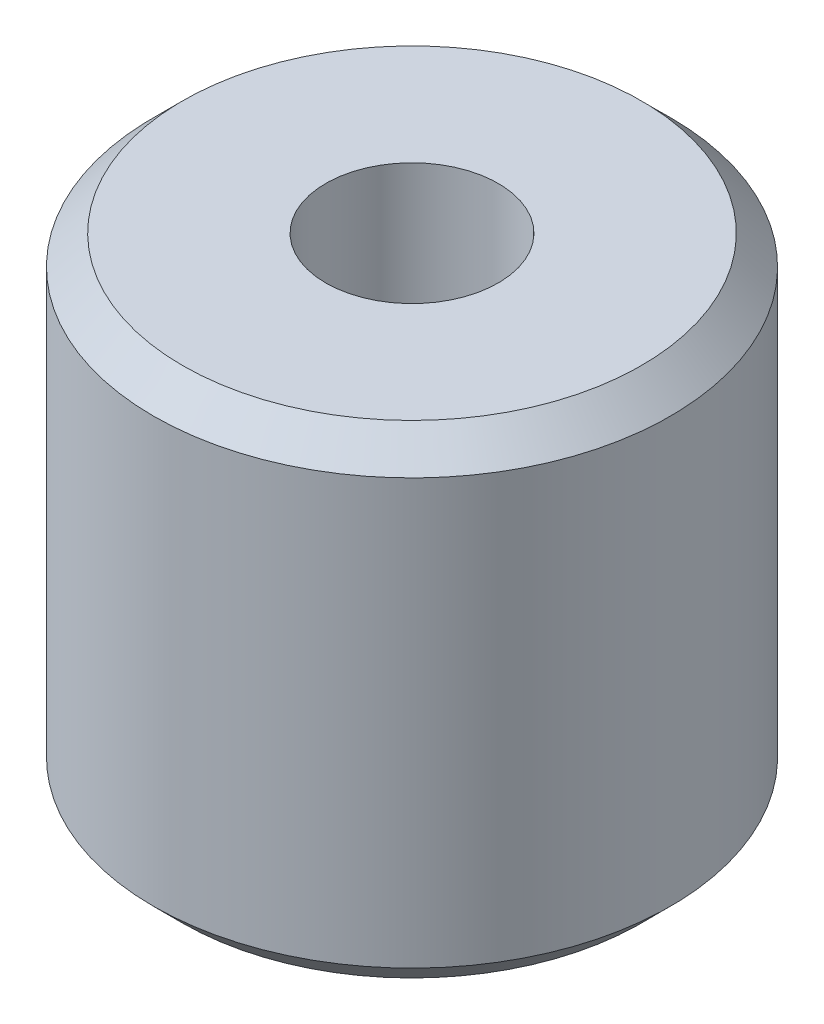
from build123d import *

# Parameters (mm, degrees)
SKETCH2_R          = 1.59
CUT_EXTRUDE1_DEPTH = 12.163352991


with BuildPart() as part:
    # Sketch1 → Revolve1 (revolve)
    with BuildSketch(Plane(origin=(0, 0, 0), x_dir=(0, 0, -1), z_dir=(1, 0, 0)), mode=Mode.PRIVATE) as revolve1_sk:
        Polygon((4.227598846, 4.45), (0, 4.45), (0, 3.912598846), (4.765, 3.912598846), align=None)
        Polygon((4.765, 3.912598846), (0, 3.912598846), (0, 0.159067097), (0, 0), (0, -3.912598846), (4.765, -3.912598846), (4.765, 0), align=None)
        Polygon((4.227598846, -4.45), (4.765, -3.912598846), (0, -3.912598846), (0, -4.45), align=None)
    revolve(revolve1_sk.sketch.rotate(Axis((0, 16.383455529, 0), (0, -1, 0)), 180), axis=Axis((0, 16.383455529, 0), (0, -1, 0)))

    # Sketch2 → Cut-Extrude1 (cut, through all)
    with BuildSketch(Plane(origin=(0, 4.45, 0), x_dir=(1, 0, 0), z_dir=(0, 1, 0))):
        with Locations(Location((0, 0, 0), (0, 0, 270))):
            Circle(SKETCH2_R)
    extrude(amount=-CUT_EXTRUDE1_DEPTH, mode=Mode.SUBTRACT)


solid = part.part
